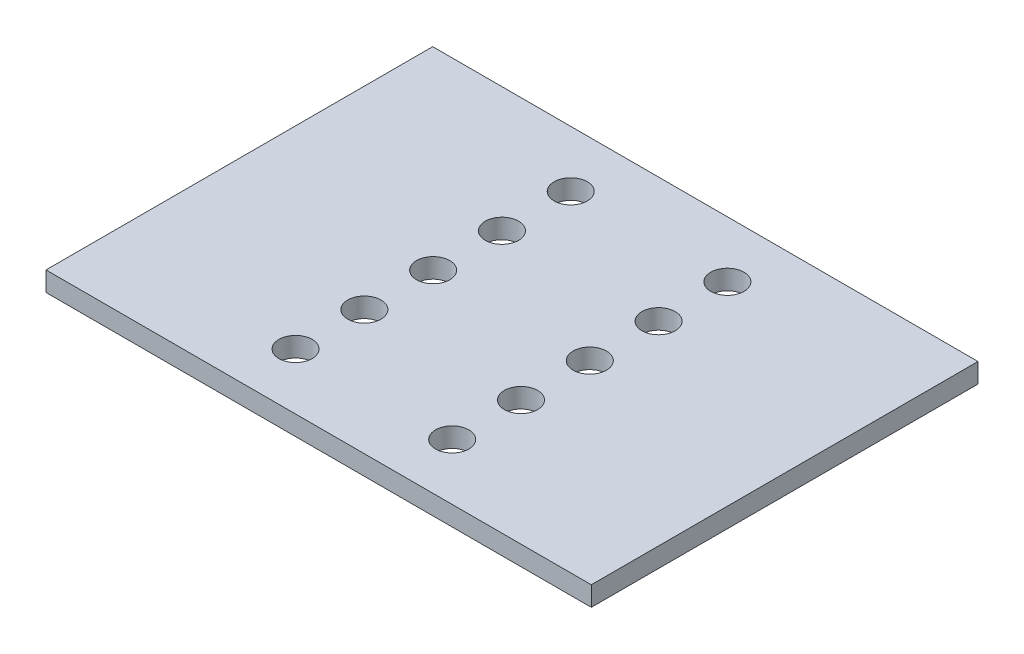
from build123d import *

# Parameters (mm, degrees)
SKETCH1_W           = 55.7
SKETCH1_H           = 39.5
BOSS_EXTRUDE1_DEPTH = 2
SKETCH2_R           = 1.7
CUT_EXTRUDE2_DEPTH  = 35.200657888


with BuildPart() as part:
    # Sketch1 → Boss-Extrude1 (new body)
    with BuildSketch(Plane(origin=(0, 0, 0), x_dir=(1, 0, 0), z_dir=(0, 1, 0))):
        Rectangle(SKETCH1_W, SKETCH1_H)
    extrude(amount=BOSS_EXTRUDE1_DEPTH)

    # Sketch2 → Cut-Extrude2 (cut, through all)
    with BuildSketch(Plane(origin=(0, 2, 0), x_dir=(1, 0, 0), z_dir=(0, 1, 0))):
        with Locations(Location((-8, 14, 0), (0, 0, 270))):
            Circle(SKETCH2_R)
        with Locations(Location((8, 14, 0), (0, 0, 90))):
            Circle(SKETCH2_R)
        with Locations(Location((7.972701567, 7.000053229, 0), (0, 0, 90))):
            Circle(SKETCH2_R)
        with Locations(Location((-8.027298433, 7.000053229, 0), (0, 0, 270))):
            Circle(SKETCH2_R)
        with Locations(Location((7.945403135, 0.000106458, 0), (0, 0, 90))):
            Circle(SKETCH2_R)
        with Locations(Location((-8.054596865, 0.000106458, 0), (0, 0, 270))):
            Circle(SKETCH2_R)
        with Locations(Location((7.918104702, -6.999840313, 0), (0, 0, 90))):
            Circle(SKETCH2_R)
        with Locations(Location((-8.081895298, -6.999840313, 0), (0, 0, 270))):
            Circle(SKETCH2_R)
        with Locations(Location((7.89080627, -13.999787084, 0), (0, 0, 90))):
            Circle(SKETCH2_R)
        with Locations(Location((-8.10919373, -13.999787084, 0), (0, 0, 270))):
            Circle(SKETCH2_R)
    extrude(amount=-CUT_EXTRUDE2_DEPTH, mode=Mode.SUBTRACT)


solid = part.part
